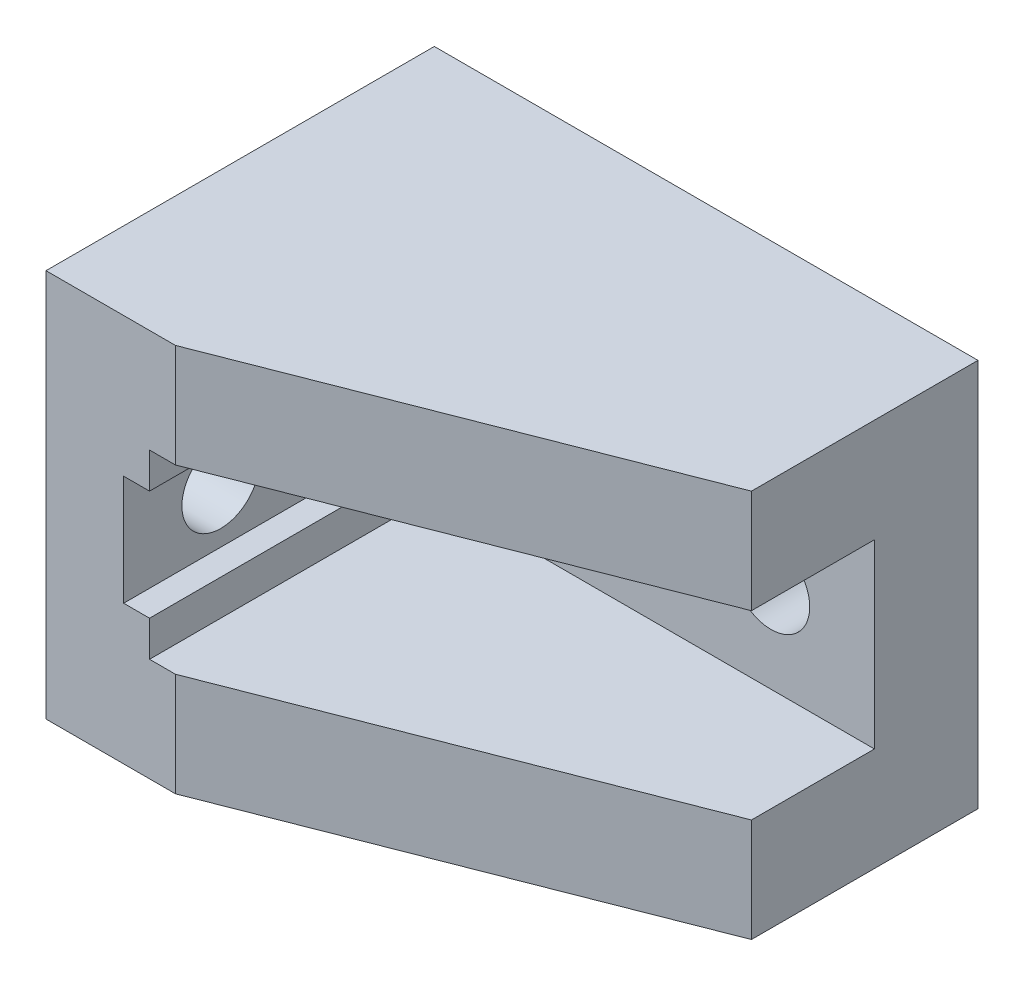
from build123d import *

# Parameters (mm, degrees)
BOSS_EXTRUDE1_DEPTH     = 30
SHELL1_T                = -8
SKETCH3_R               = 3
CUT_EXTRUDE1_DEPTH      = 30
SKETCH4_R               = 3
CUT_EXTRUDE2_DEPTH      = 10
CUT_EXTRUDE3_DEPTH      = 57.107040556
CUT_EXTRUDE3_DEPTH_BACK = 57.107040556
SKETCH8_W               = 3.5
SKETCH8_H               = 8.5


with BuildPart() as part:
    # Sketch2 → Boss-Extrude1 (new body)
    with BuildSketch(Plane(origin=(0, 0, 0), x_dir=(1, 0, 0), z_dir=(0, 1, 0))):
        Polygon((10, -30), (42, -17.5), (42, 0), (0, 0), (0, -30), align=None)
    extrude(amount=BOSS_EXTRUDE1_DEPTH)

    # Shell1
    shell1_openings = [part.faces().sort_by_distance(p)[0] for p in [
        (42, 15, 8.75),
        (26, 15, 23.75),
        (5, 15, 30),
    ]]
    offset(amount=SHELL1_T, openings=shell1_openings, kind=Kind.INTERSECTION)

    # Sketch3 → Cut-Extrude1 (cut)
    with BuildSketch(Plane(origin=(8, 0, 0), x_dir=(0, 0, -1), z_dir=(1, 0, 0))):
        with Locations((-22.5, 15)):
            Circle(SKETCH3_R)
        with Locations((-7.5, 15)):
            Circle(SKETCH3_R)
    extrude(amount=-CUT_EXTRUDE1_DEPTH, mode=Mode.SUBTRACT)

    # Sketch4 → Cut-Extrude2 (cut)
    with BuildSketch(Plane.XY.offset(8)):
        with Locations((16, 15)):
            Circle(SKETCH4_R)
        with Locations((34, 15)):
            Circle(SKETCH4_R)
    extrude(amount=-CUT_EXTRUDE2_DEPTH, mode=Mode.SUBTRACT)

    # Sketch8 → Cut-Extrude3 (cut, two sides: drawn at the far end of the back side and taken through both)
    with BuildSketch(Plane.XY.offset(8).offset(-CUT_EXTRUDE3_DEPTH_BACK)):
        with Locations((7.75, 15)):
            Rectangle(SKETCH8_W, SKETCH8_H)
    extrude(amount=CUT_EXTRUDE3_DEPTH + CUT_EXTRUDE3_DEPTH_BACK, mode=Mode.SUBTRACT)


solid = part.part
